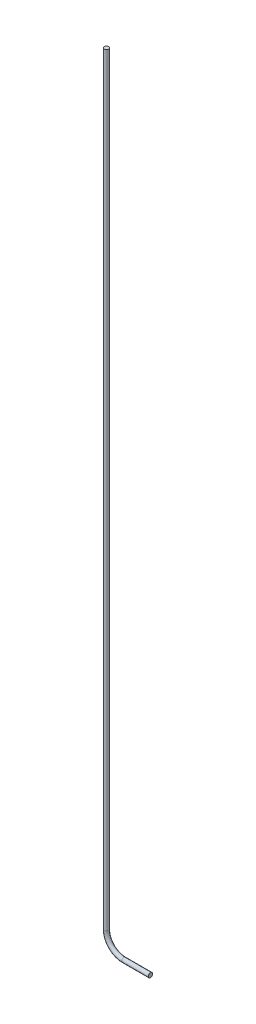
from build123d import *

# Parameters (mm, degrees)
SWEEP1_PROFILE_R = 6.35


with BuildPart() as part:
    # Sweep1: sweep along a path in Sketch1
    with BuildLine(Plane.XY) as sweep1_path:
        Line((0, 2253.996), (0, 50.8))
        ThreePointArc((0, 50.8), (14.878975516, 14.878975516), (50.8, 0))
        Line((50.8, 0), (127, 0))
    # Sweep1 profile (on start of the path) → Sweep1 (sweep)
    with BuildSketch(Plane(origin=(0, 2253.996, 0), x_dir=(0, 0, -1), z_dir=(0, -1, 0))):
        Circle(SWEEP1_PROFILE_R)
    sweep(path=sweep1_path.line)


solid = part.part
